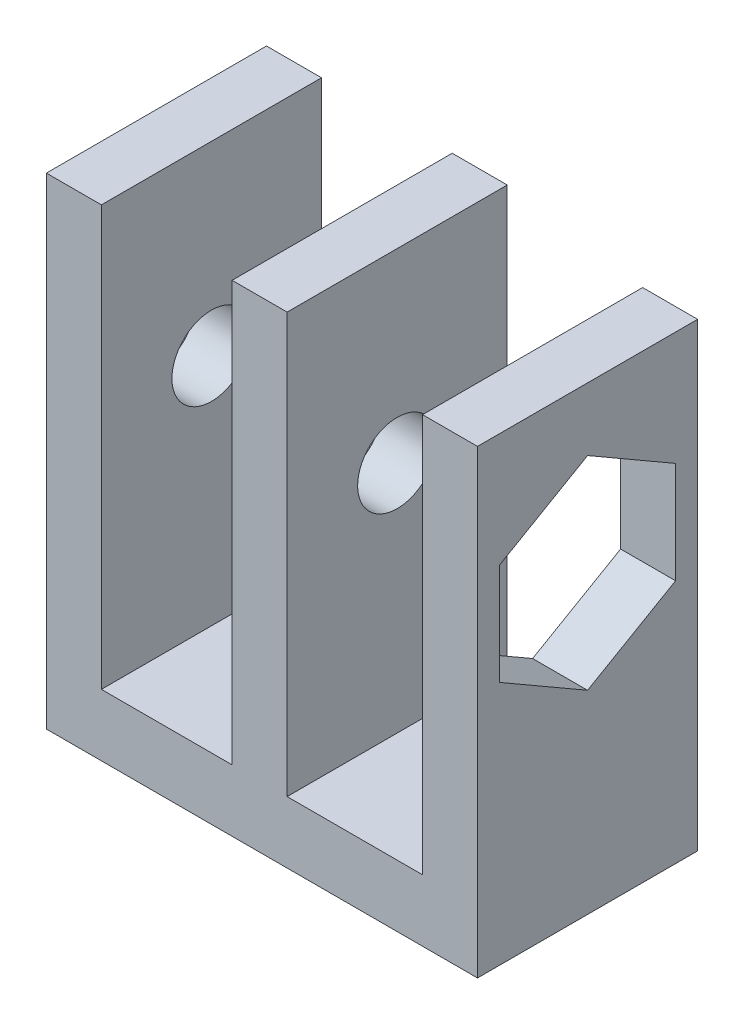
from build123d import *

# Parameters (mm, degrees)
EXTRUSION1_DEPTH   = 8.128
SKETCH2_R          = 1.4605
CUT_EXTRUDE2_DEPTH = 10
CUT_EXTRUDE3_REACH = 27.212


with BuildPart() as part:
    # Sketch1 → Extrusion1 (new body)
    with BuildSketch(Plane.XY):
        Polygon((0, 17.78), (2.032, 17.78), (2.032, 2.286), (6.858, 2.286), (6.858, 17.78), (8.89, 17.78), (8.89, 0), (0, 0), (0, 2.154296207), align=None)
        Polygon((8.89, 2.286), (8.89, 0), (15.24, 0), (15.92, 0), (15.92, 17), (13.89, 17), (13.89, 2.286), align=None)
    extrude(amount=EXTRUSION1_DEPTH)

    # Sketch2 → Cut-Extrude2 (cut)
    with BuildSketch(Plane(origin=(8.89, 0, 0), x_dir=(0, 0, -1), z_dir=(1, 0, 0))):
        with Locations(Location((-4.064, 10.922, 0), (0, 0, 90))):
            Circle(SKETCH2_R)
    extrude(amount=-CUT_EXTRUDE2_DEPTH, mode=Mode.SUBTRACT)

    # Sketch4 → Cut-Extrude3 (cut, up to next)
    with BuildSketch(Plane(origin=(15.92, 0, 0), x_dir=(0, 0, -1), z_dir=(1, 0, 0)), mode=Mode.PRIVATE) as cut_extrude3_sk1:
        Polygon((-4.064, 14.67477675), (-7.314, 12.798388375), (-7.314, 9.045611625), (-4.064, 7.16922325), (-0.814, 9.045611625), (-0.814, 12.798388375), align=None)
    cut_extrude3_tool1 = extrude(cut_extrude3_sk1.sketch, amount=-CUT_EXTRUDE3_REACH, mode=Mode.PRIVATE) & part.part
    add(cut_extrude3_tool1.solids().sort_by_distance((15.92, 10.922, 4.064))[0], mode=Mode.SUBTRACT)


solid = part.part
